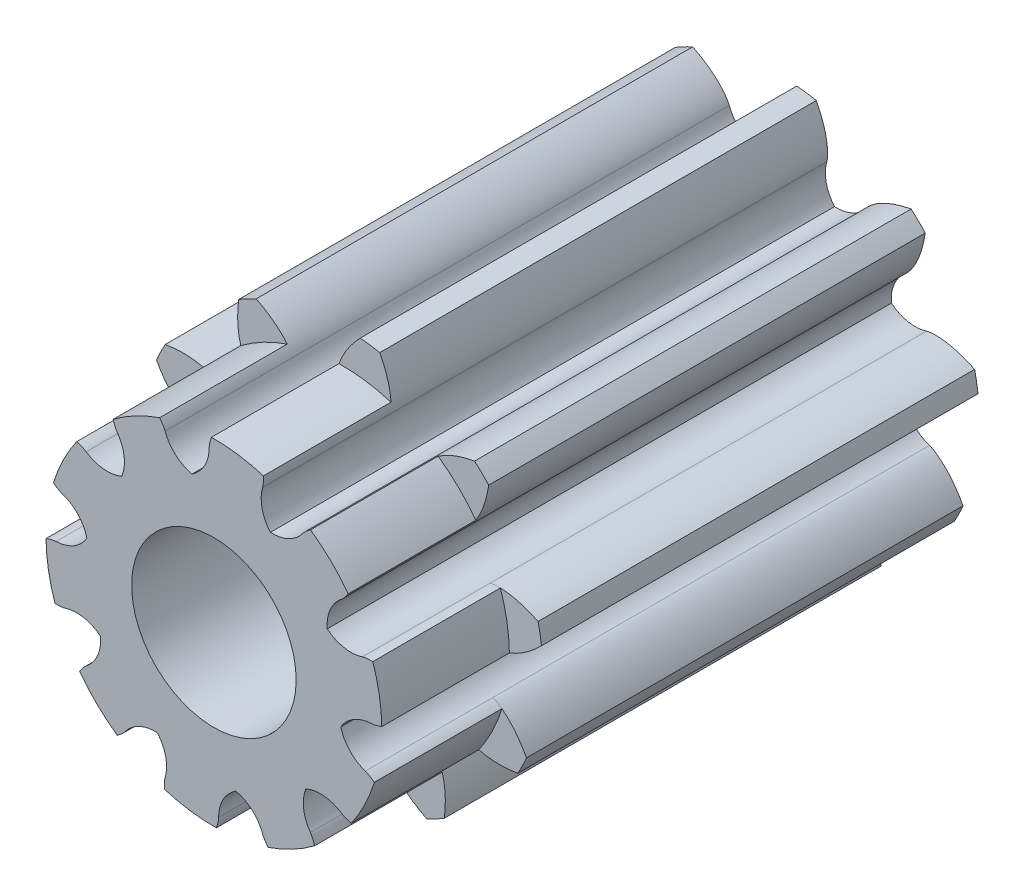
from build123d import *

# Parameters (mm, degrees)
SKETCH3_R           = 1.875
BOSS_EXTRUDE1_DEPTH = 6.5
BOSS_EXTRUDE2_DEPTH = 6.5
CIRPATTERN1_COUNT   = 10
SKETCH4_R           = 1.225
CUT_EXTRUDE1_DEPTH  = 6.5
SKETCH5_R           = 1.225
BOSS_EXTRUDE3_DEPTH = 1.9


with BuildPart() as part:
    # Sketch3 → Boss-Extrude1 (new body)
    with BuildSketch(Plane.XY):
        with Locations(Location((0, 0, 0), (0, 0, 180))):
            Circle(SKETCH3_R)
    extrude(amount=BOSS_EXTRUDE1_DEPTH)

    # Sketch3<3> → Boss-Extrude2 (add)
    with BuildSketch(Plane.XY):
        with BuildLine():
            ThreePointArc((1.573427464, 1.019779886), (1.798026904, 0.531718208), (1.875, 0))
            ThreePointArc((1.875, 0), (1.862497968, -0.216162711), (1.825158594, -0.429442784))
            ThreePointArc((1.825158594, -0.429442784), (2.014458792, -0.125957255), (2.349231552, 0))
            add(Edge.make_bspline(
                [(2.349231552, 0), (2.353516916, 0.000142534), (2.365509663, 0.000982564), (2.388039751, 0.004306438), (2.424368115, 0.012168815), (2.469850364, 0.025726376), (2.527393126, 0.047232913), (2.593300448, 0.077577751), (2.663398112, 0.116025456), (2.736795079, 0.163159899), (2.807217786, 0.214721581), (2.876760102, 0.271956976), (2.9270287, 0.318038021), (2.960113703, 0.350569853), (2.977331438, 0.368099859)],
                knots=[0, 0, 0, 0, 0, 0.005376747, 0.015083687, 0.028531819, 0.046610138, 0.064854847, 0.092110523, 0.119476173, 0.146842493, 0.174208852, 0.201574954, 0.232398428, 0.232398428, 0.232398428, 0.232398428, 0.232398428], degree=4))
            ThreePointArc((2.977331438, 0.368099859), (2.955741103, 0.51341458), (2.927062733, 0.657498105))
            add(Edge.make_bspline(
                [(2.211621643, 0.792223827), (2.215704051, 0.793534782), (2.227277585, 0.796788234), (2.249608837, 0.80125681), (2.286460615, 0.806105882), (2.333850643, 0.80868031), (2.395275328, 0.807838513), (2.467555119, 0.801496886), (2.546512298, 0.788940126), (2.631504921, 0.769318081), (2.715190488, 0.744525128), (2.799960563, 0.714093919), (2.862824362, 0.687664061), (2.904941965, 0.668194981), (2.927062733, 0.657498105)],
                knots=[0, 0, 0, 0, 0, 0.005376747, 0.015083687, 0.028531819, 0.046610138, 0.064854847, 0.092110523, 0.119476173, 0.146842493, 0.174208852, 0.201574954, 0.232398428, 0.232398428, 0.232398428, 0.232398428, 0.232398428], degree=4))
            ThreePointArc((2.211621643, 0.792223827), (1.853982559, 0.797908595), (1.573427464, 1.019779886))
        make_face()
    boss_extrude2 = extrude(amount=BOSS_EXTRUDE2_DEPTH)

    # CirPattern1: Boss-Extrude2 ×10 about axis
    cirpattern1_axis = Axis((0, 0, 6.5), (0, 0, -1))
    for i in range(1, CIRPATTERN1_COUNT):
        add(boss_extrude2.rotate(cirpattern1_axis, i * 360 / CIRPATTERN1_COUNT))

    # Sketch4 → Cut-Extrude1 (cut)
    with BuildSketch(Plane.XY.offset(6.5)):
        Circle(SKETCH4_R)
    extrude(amount=-CUT_EXTRUDE1_DEPTH, mode=Mode.SUBTRACT)

    # Sketch5 → Boss-Extrude3 (add)
    with BuildSketch(Plane.XY.offset(6.5)):
        with BuildLine():
            ThreePointArc((-0.807894478, 2.365862742), (-1.168050428, 2.210352505), (-1.499445101, 2.000416054))
            add(Edge.make_bspline(
                [(-1.499445101, 2.000416054), (-1.494757852, 1.984950215), (-1.486314689, 1.959422743), (-1.473962201, 1.927035519), (-1.457207872, 1.891903172), (-1.446057267, 1.872045756), (-1.439386632, 1.862044043), (-1.436878306, 1.858566549)],
                knots=[0.183589508, 0.183589508, 0.183589508, 0.183589508, 0.183589508, 0.203866609, 0.217314741, 0.22702168, 0.232398428, 0.232398428, 0.232398428, 0.232398428, 0.232398428], degree=4))
            ThreePointArc((-1.436878306, 1.858566549), (-1.33597317, 1.602603039), (-1.369791724, 1.329554563))
            ThreePointArc((-1.369791724, 1.329554563), (-1.641710894, 1.287612578), (-1.900568249, 1.38084366))
            add(Edge.make_bspline(
                [(-1.900568249, 1.38084366), (-1.904118961, 1.383247222), (-1.914315054, 1.389616783), (-1.934496002, 1.400170566), (-1.970112118, 1.4158703), (-2.002853129, 1.42725197), (-2.028620915, 1.434930511), (-2.044219591, 1.439154705)],
                knots=[0, 0, 0, 0, 0, 0.005376747, 0.015083687, 0.028531819, 0.048808919, 0.048808919, 0.048808919, 0.048808919, 0.048808919], degree=4))
            ThreePointArc((-2.044219591, 1.439154705), (-2.244185252, 1.101649924), (-2.388891624, 0.737018866))
            add(Edge.make_bspline(
                [(-2.388891624, 0.737018866), (-2.376008967, 0.727261836), (-2.354173634, 0.711572444), (-2.325143529, 0.69263124), (-2.290938716, 0.674056521), (-2.270245791, 0.664545695), (-2.258970274, 0.66037504), (-2.254896977, 0.659036046)],
                knots=[0.183589508, 0.183589508, 0.183589508, 0.183589508, 0.183589508, 0.203866609, 0.217314741, 0.22702168, 0.232398428, 0.232398428, 0.232398428, 0.232398428, 0.232398428], degree=4))
            ThreePointArc((-2.254896977, 0.659036046), (-2.02281143, 0.511267767), (-1.889677347, 0.270488862))
            ThreePointArc((-1.889677347, 0.270488862), (-2.085011697, 0.076727006), (-2.349231552, 0))
            add(Edge.make_bspline(
                [(-2.349231552, 0), (-2.353516916, -0.000142534), (-2.365509663, -0.000982564), (-2.388039751, -0.004306438), (-2.426081865, -0.012539714), (-2.459259878, -0.022576433), (-2.484619788, -0.031510287), (-2.4997223, -0.037261514)],
                knots=[0, 0, 0, 0, 0, 0.005376747, 0.015083687, 0.028531819, 0.048808919, 0.048808919, 0.048808919, 0.048808919, 0.048808919], degree=4))
            ThreePointArc((-2.4997223, -0.037261514), (-2.463117586, -0.427845484), (-2.365862742, -0.807894478))
            add(Edge.make_bspline(
                [(-2.365862742, -0.807894478), (-2.349705415, -0.808215846), (-2.322818266, -0.808074344), (-2.288199057, -0.806334632), (-2.249608837, -0.80125681), (-2.227277585, -0.796788234), (-2.215704051, -0.793534782), (-2.211621643, -0.792223827)],
                knots=[0.183589508, 0.183589508, 0.183589508, 0.183589508, 0.183589508, 0.203866609, 0.217314741, 0.22702168, 0.232398428, 0.232398428, 0.232398428, 0.232398428, 0.232398428], degree=4))
            ThreePointArc((-2.211621643, -0.792223827), (-1.937004477, -0.775354414), (-1.687770452, -0.89189439))
            ThreePointArc((-1.687770452, -0.89189439), (-1.731908899, -1.163465675), (-1.900568249, -1.38084366))
            add(Edge.make_bspline(
                [(-1.900568249, -1.38084366), (-1.903951402, -1.383477846), (-1.913159981, -1.391206605), (-1.929433481, -1.407138529), (-1.9553708, -1.436159983), (-1.97631294, -1.463781406), (-1.991578351, -1.485915227), (-2.000416054, -1.499445101)],
                knots=[0, 0, 0, 0, 0, 0.005376747, 0.015083687, 0.028531819, 0.048808919, 0.048808919, 0.048808919, 0.048808919, 0.048808919], degree=4))
            ThreePointArc((-2.000416054, -1.499445101), (-1.741222721, -1.793918459), (-1.439154705, -2.044219591))
            add(Edge.make_bspline(
                [(-1.439154705, -2.044219591), (-1.425894258, -2.034982544), (-1.40422527, -2.019064197), (-1.377240319, -1.99730808), (-1.349004844, -1.970517274), (-1.333565044, -1.95377614), (-1.32611419, -1.944341289), (-1.323582012, -1.940881125)],
                knots=[0.183589508, 0.183589508, 0.183589508, 0.183589508, 0.183589508, 0.203866609, 0.217314741, 0.22702168, 0.232398428, 0.232398428, 0.232398428, 0.232398428, 0.232398428], degree=4))
            ThreePointArc((-1.323582012, -1.940881125), (-1.11132765, -1.765817563), (-0.841192609, -1.7136043))
            ThreePointArc((-0.841192609, -1.7136043), (-0.717275767, -1.959254012), (-0.725952473, -2.234251976))
            add(Edge.make_bspline(
                [(-0.725952473, -2.234251976), (-0.727141166, -2.238371644), (-0.730048213, -2.250037008), (-0.7338492, -2.272491529), (-0.737774549, -2.311215952), (-0.738481632, -2.345871634), (-0.737821675, -2.372751054), (-0.737018866, -2.388891624)],
                knots=[0, 0, 0, 0, 0, 0.005376747, 0.015083687, 0.028531819, 0.048808919, 0.048808919, 0.048808919, 0.048808919, 0.048808919], degree=4))
            ThreePointArc((-0.737018866, -2.388891624), (-0.354239958, -2.474775556), (0.037261514, -2.4997223))
            add(Edge.make_bspline(
                [(0.037261514, -2.4997223), (0.042560041, -2.484455078), (0.050734051, -2.458840153), (0.059777411, -2.425377728), (0.066873149, -2.387107115), (0.069524017, -2.364487966), (0.070006219, -2.352475509), (0.070020961, -2.348187801)],
                knots=[0.183589508, 0.183589508, 0.183589508, 0.183589508, 0.183589508, 0.203866609, 0.217314741, 0.22702168, 0.232398428, 0.232398428, 0.232398428, 0.232398428, 0.232398428], degree=4))
            ThreePointArc((0.070020961, -2.348187801), (0.138838567, -2.08179842), (0.326692219, -1.88077561))
            ThreePointArc((0.326692219, -1.88077561), (0.571332329, -2.00667391), (0.725952473, -2.234251976))
            add(Edge.make_bspline(
                [(0.725952473, -2.234251976), (0.727412281, -2.238283553), (0.73191716, -2.24942975), (0.742040532, -2.269830004), (0.761626503, -2.303465983), (0.78142456, -2.331918631), (0.797757803, -2.353276626), (0.807894478, -2.365862742)],
                knots=[0, 0, 0, 0, 0, 0.005376747, 0.015083687, 0.028531819, 0.048808919, 0.048808919, 0.048808919, 0.048808919, 0.048808919], degree=4))
            ThreePointArc((0.807894478, -2.365862742), (1.168050428, -2.210352505), (1.499445101, -2.000416054))
            add(Edge.make_bspline(
                [(1.499445101, -2.000416054), (1.494757852, -1.984950215), (1.486314689, -1.959422743), (1.473962201, -1.927035519), (1.457207872, -1.891903172), (1.446057267, -1.872045756), (1.439386632, -1.862044043), (1.436878306, -1.858566549)],
                knots=[0.183589508, 0.183589508, 0.183589508, 0.183589508, 0.183589508, 0.203866609, 0.217314741, 0.22702168, 0.232398428, 0.232398428, 0.232398428, 0.232398428, 0.232398428], degree=4))
            ThreePointArc((1.436878306, -1.858566549), (1.33597317, -1.602603039), (1.369791724, -1.329554563))
            ThreePointArc((1.369791724, -1.329554563), (1.641710894, -1.287612578), (1.900568249, -1.38084366))
            add(Edge.make_bspline(
                [(1.900568249, -1.38084366), (1.904118961, -1.383247222), (1.914315054, -1.389616783), (1.934496002, -1.400170566), (1.970112118, -1.4158703), (2.002853129, -1.42725197), (2.028620915, -1.434930511), (2.044219591, -1.439154705)],
                knots=[0, 0, 0, 0, 0, 0.005376747, 0.015083687, 0.028531819, 0.048808919, 0.048808919, 0.048808919, 0.048808919, 0.048808919], degree=4))
            ThreePointArc((2.044219591, -1.439154705), (2.244185252, -1.101649924), (2.388891624, -0.737018866))
            add(Edge.make_bspline(
                [(2.388891624, -0.737018866), (2.376008967, -0.727261836), (2.354173634, -0.711572444), (2.325143529, -0.69263124), (2.290938716, -0.674056521), (2.270245791, -0.664545695), (2.258970274, -0.66037504), (2.254896977, -0.659036046)],
                knots=[0.183589508, 0.183589508, 0.183589508, 0.183589508, 0.183589508, 0.203866609, 0.217314741, 0.22702168, 0.232398428, 0.232398428, 0.232398428, 0.232398428, 0.232398428], degree=4))
            ThreePointArc((2.254896977, -0.659036046), (2.02281143, -0.511267767), (1.889677347, -0.270488862))
            ThreePointArc((1.889677347, -0.270488862), (2.085011697, -0.076727006), (2.349231552, 0))
            add(Edge.make_bspline(
                [(2.349231552, 0), (2.353516916, 0.000142534), (2.365509663, 0.000982564), (2.388039751, 0.004306438), (2.426081866, 0.012539714), (2.459259878, 0.022576433), (2.484619788, 0.031510287), (2.4997223, 0.037261514)],
                knots=[0, 0, 0, 0, 0, 0.005376747, 0.015083687, 0.028531819, 0.048808919, 0.048808919, 0.048808919, 0.048808919, 0.048808919], degree=4))
            ThreePointArc((2.4997223, 0.037261514), (2.463117586, 0.427845484), (2.365862742, 0.807894478))
            add(Edge.make_bspline(
                [(2.365862742, 0.807894478), (2.349705415, 0.808215846), (2.322818266, 0.808074344), (2.288199057, 0.806334632), (2.249608837, 0.80125681), (2.227277585, 0.796788234), (2.215704051, 0.793534782), (2.211621643, 0.792223827)],
                knots=[0.183589508, 0.183589508, 0.183589508, 0.183589508, 0.183589508, 0.203866609, 0.217314741, 0.22702168, 0.232398428, 0.232398428, 0.232398428, 0.232398428, 0.232398428], degree=4))
            ThreePointArc((2.211621643, 0.792223827), (1.937004477, 0.775354414), (1.687770452, 0.89189439))
            ThreePointArc((1.687770452, 0.89189439), (1.731908899, 1.163465675), (1.900568249, 1.38084366))
            add(Edge.make_bspline(
                [(1.900568249, 1.38084366), (1.903951402, 1.383477846), (1.913159981, 1.391206605), (1.929433481, 1.407138529), (1.9553708, 1.436159983), (1.97631294, 1.463781406), (1.991578351, 1.485915227), (2.000416054, 1.499445101)],
                knots=[0, 0, 0, 0, 0, 0.005376747, 0.015083687, 0.028531819, 0.048808919, 0.048808919, 0.048808919, 0.048808919, 0.048808919], degree=4))
            ThreePointArc((2.000416054, 1.499445101), (1.741222721, 1.793918459), (1.439154705, 2.044219591))
            add(Edge.make_bspline(
                [(1.439154705, 2.044219591), (1.425894258, 2.034982544), (1.40422527, 2.019064197), (1.377240319, 1.99730808), (1.349004844, 1.970517274), (1.333565044, 1.95377614), (1.32611419, 1.944341289), (1.323582012, 1.940881125)],
                knots=[0.183589508, 0.183589508, 0.183589508, 0.183589508, 0.183589508, 0.203866609, 0.217314741, 0.22702168, 0.232398428, 0.232398428, 0.232398428, 0.232398428, 0.232398428], degree=4))
            ThreePointArc((1.323582012, 1.940881125), (1.11132765, 1.765817563), (0.841192609, 1.7136043))
            ThreePointArc((0.841192609, 1.7136043), (0.717275767, 1.959254012), (0.725952473, 2.234251976))
            add(Edge.make_bspline(
                [(0.725952473, 2.234251976), (0.727141166, 2.238371644), (0.730048213, 2.250037008), (0.7338492, 2.272491529), (0.737774549, 2.311215952), (0.738481632, 2.345871634), (0.737821675, 2.372751054), (0.737018866, 2.388891624)],
                knots=[0, 0, 0, 0, 0, 0.005376747, 0.015083687, 0.028531819, 0.048808919, 0.048808919, 0.048808919, 0.048808919, 0.048808919], degree=4))
            ThreePointArc((0.737018866, 2.388891624), (0.354239958, 2.474775556), (-0.037261514, 2.4997223))
            add(Edge.make_bspline(
                [(-0.037261514, 2.4997223), (-0.042560041, 2.484455078), (-0.050734051, 2.458840153), (-0.059777411, 2.425377728), (-0.066873149, 2.387107115), (-0.069524017, 2.364487966), (-0.070006219, 2.352475509), (-0.070020961, 2.348187801)],
                knots=[0.183589508, 0.183589508, 0.183589508, 0.183589508, 0.183589508, 0.203866609, 0.217314741, 0.22702168, 0.232398428, 0.232398428, 0.232398428, 0.232398428, 0.232398428], degree=4))
            ThreePointArc((-0.070020961, 2.348187801), (-0.138838567, 2.08179842), (-0.326692219, 1.88077561))
            ThreePointArc((-0.326692219, 1.88077561), (-0.571332329, 2.00667391), (-0.725952473, 2.234251976))
            add(Edge.make_bspline(
                [(-0.725952473, 2.234251976), (-0.727412281, 2.238283553), (-0.73191716, 2.24942975), (-0.742040532, 2.269830004), (-0.761626503, 2.303465983), (-0.78142456, 2.331918631), (-0.797757803, 2.353276626), (-0.807894478, 2.365862742)],
                knots=[0, 0, 0, 0, 0, 0.005376747, 0.015083687, 0.028531819, 0.048808919, 0.048808919, 0.048808919, 0.048808919, 0.048808919], degree=4))
        make_face()
        Circle(SKETCH5_R, mode=Mode.SUBTRACT)
    extrude(amount=BOSS_EXTRUDE3_DEPTH)


solid = part.part
